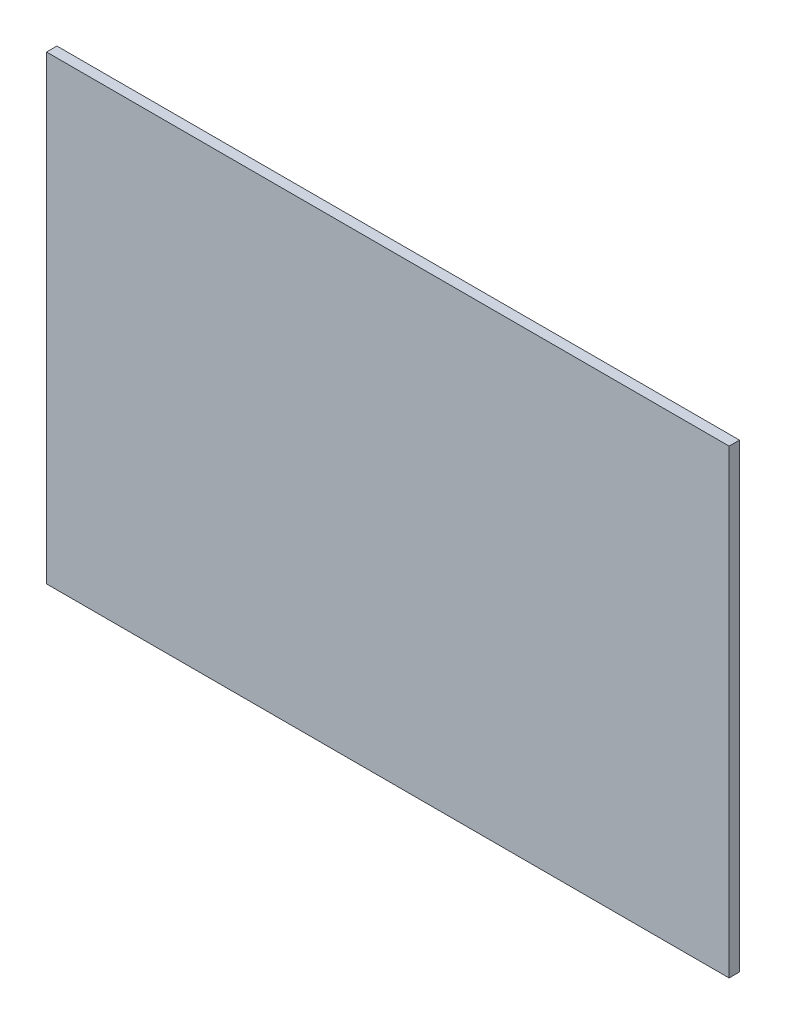
from build123d import *

# Parameters (mm, degrees)
SKETCH1_W           = 104.4448
SKETCH1_H           = 70.485
BOSS_EXTRUDE1_DEPTH = 1.5875


with BuildPart() as part:
    # Sketch1 → Boss-Extrude1 (new body)
    with BuildSketch(Plane.XY):
        Rectangle(SKETCH1_W, SKETCH1_H)
    extrude(amount=BOSS_EXTRUDE1_DEPTH)


solid = part.part
